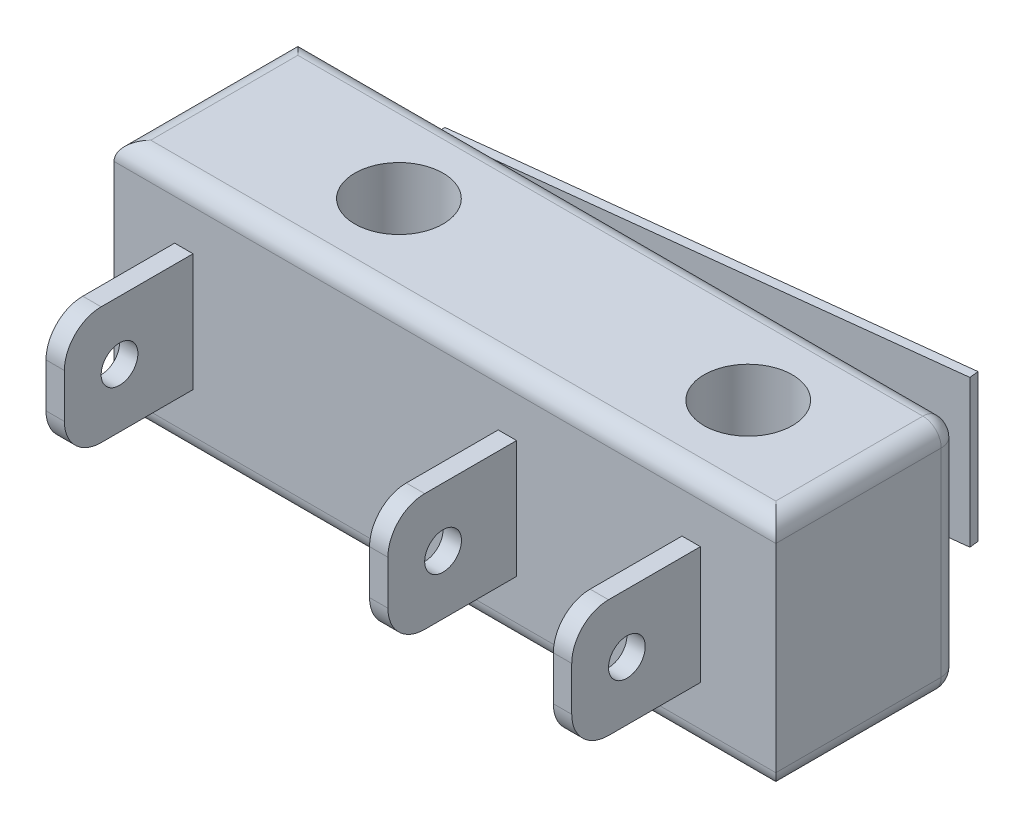
from build123d import *

# Parameters (mm, degrees)
SKETCH1_W                = 18
SKETCH1_H                = 5
SKETCH1_R                = 1.2
BOSS_EXTRUDE1_DEPTH      = 6.4
SKETCH2_W                = 0.5
SKETCH2_H                = 3.2
BOSS_EXTRUDE2_DEPTH      = 3.5
SKETCH3_R                = 0.5
CUT_EXTRUDE1_DEPTH       = 19.256026402
FILLET1_R                = 1
FILLET2_R                = 0.5
EXTRUDE_THIN2_DEPTH      = 2
EXTRUDE_THIN2_DEPTH_BACK = 2
BOSS_EXTRUDE6_DEPTH      = 0.5
BOSS_EXTRUDE6_DEPTH_BACK = 0.5


with BuildPart() as part:
    # Sketch1 → Boss-Extrude1 (new body)
    with BuildSketch(Plane(origin=(0, 0, 0), x_dir=(1, 0, 0), z_dir=(0, 1, 0))):
        with Locations((9, 2.5)):
            Rectangle(SKETCH1_W, SKETCH1_H)
        with Locations(Location((5.25, 2.5, 0), (0, 0, 270))):
            Circle(SKETCH1_R, mode=Mode.SUBTRACT)
        with Locations(Location((14.75, 2.5, 0), (0, 0, 270))):
            Circle(SKETCH1_R, mode=Mode.SUBTRACT)
    extrude(amount=BOSS_EXTRUDE1_DEPTH)

    # Sketch2 → Boss-Extrude2 (add)
    with BuildSketch(Plane.XY):
        with Locations((15.7, 3.2)):
            Rectangle(SKETCH2_W, SKETCH2_H)
        with Locations((10.7, 3.2)):
            Rectangle(SKETCH2_W, SKETCH2_H)
        with Locations((1.9, 3.2)):
            Rectangle(SKETCH2_W, SKETCH2_H)
    extrude(amount=BOSS_EXTRUDE2_DEPTH)

    # Sketch3 → Cut-Extrude1 (cut, through all)
    with BuildSketch(Plane.ZY.offset(-1.65)):
        with Locations(Location((2, 3.2, 0), (0, 0, 270))):
            Circle(SKETCH3_R)
    extrude(amount=-CUT_EXTRUDE1_DEPTH, mode=Mode.SUBTRACT)

    # Fillet1
    fillet1_edges = [part.edges().sort_by_distance(p)[0] for p in [
        (15.7, 1.6, 3.5),
        (15.7, 4.8, 3.5),
        (10.7, 4.8, 3.5),
        (10.7, 1.6, 3.5),
        (1.9, 4.8, 3.5),
        (1.9, 1.6, 3.5),
    ]]
    fillet(fillet1_edges, radius=FILLET1_R)

    # Fillet2
    fillet2_edges = [part.edges().sort_by_distance(p)[0] for p in [
        (18, 6.4, -2.5),
        (9, 6.4, -5),
        (0, 6.4, -2.5),
        (9, 0, -5),
        (18, 0, -2.5),
        (9, 0, 0),
        (0, 0, -2.5),
        (9, 6.4, 0),
        (18, 3.2, -5),
    ]]
    fillet(fillet2_edges, radius=FILLET2_R)

    # Sketch4 → Extrude-Thin2 (add, two sides: drawn at the far end of the back side and taken through both)
    with BuildSketch(Plane(origin=(0, 3.2, 0), x_dir=(1, 0, 0), z_dir=(0, 1, 0)).offset(-EXTRUDE_THIN2_DEPTH_BACK)):
        Polygon((3, 5), (3, 6), (16, 7.5), (16.028656027, 7.251647766), (3.25, 5.777187455), (3.25, 5), align=None)
    extrude(amount=EXTRUDE_THIN2_DEPTH + EXTRUDE_THIN2_DEPTH_BACK)


with BuildPart() as body_2:
    # Sketch5 → Boss-Extrude6 (new, two sides: drawn at the far end of the back side and taken through both)
    with BuildSketch(Plane(origin=(0, 3.2, 0), x_dir=(1, 0, 0), z_dir=(0, 1, 0)).offset(-BOSS_EXTRUDE6_DEPTH_BACK)):
        with BuildLine():
            Line((4.75, 5), (4.75, 5.281826744))
            ThreePointArc((4.75, 5.281826744), (5.5, 6.031826744), (6.25, 5.281826744))
            Line((6.25, 5.281826744), (6.25, 5))
            Line((6.25, 5), (4.75, 5))
        make_face()
    extrude(amount=BOSS_EXTRUDE6_DEPTH + BOSS_EXTRUDE6_DEPTH_BACK)


solid = Compound([part.part, body_2.part])
